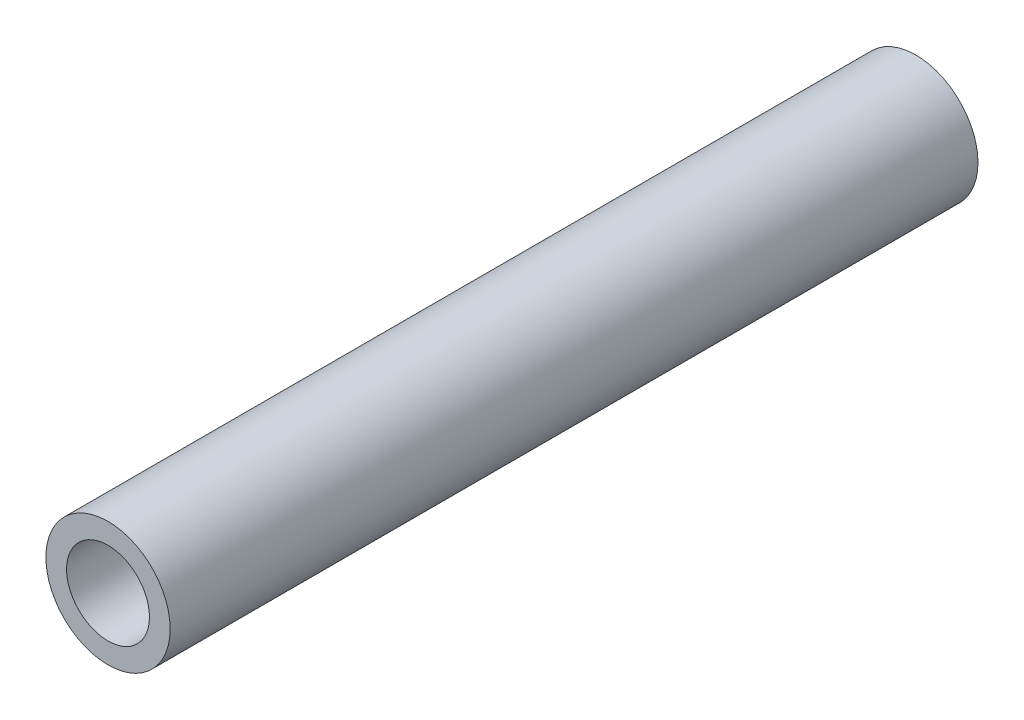
from build123d import *

# Parameters (mm, degrees)
ESQUISSE1_R        = 3
ESQUISSE1_R_2      = 2
EXTRU_MINCE1_DEPTH = 19.5


with BuildPart() as part:
    # Esquisse1 → Extru.-Mince1 (new, symmetric)
    with BuildSketch(Plane.XY):
        Circle(ESQUISSE1_R)
        Circle(ESQUISSE1_R_2, mode=Mode.SUBTRACT)
    extrude(amount=EXTRU_MINCE1_DEPTH, both=True)


solid = part.part
